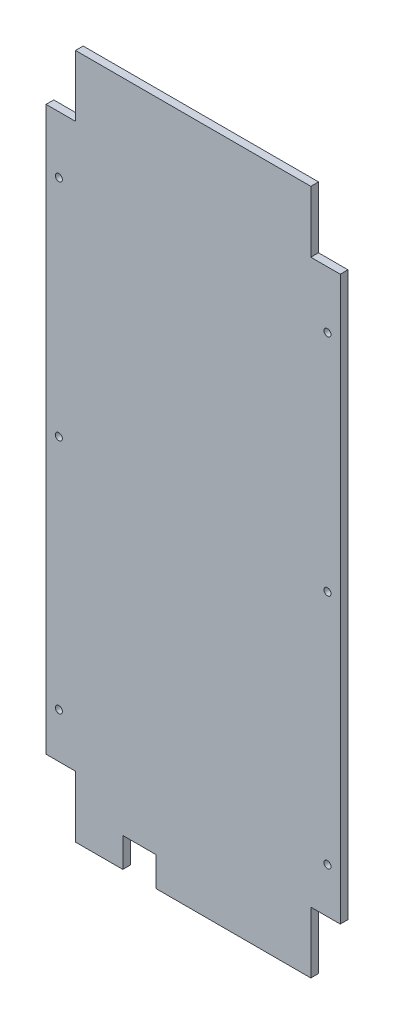
from build123d import *

# Parameters (mm, degrees)
BOSS_EXTRUDE1_DEPTH = 6
SKETCH2_R           = 2.75
CUT_EXTRUDE1_DEPTH  = 10


with BuildPart() as part:
    # Sketch1 → Boss-Extrude1 (new body)
    with BuildSketch(Plane.XY):
        Polygon((95.814780717, -438.587306273), (95.814780717, -390.58730627), (118.814780717, -390.58730627), (118.814780717, 49.41269373), (95.814780717, 49.41269373), (95.814780717, 97.41269373), (-88.185219283, 97.41269373), (-88.185219283, 49.41269373), (-111.185219283, 49.41269373), (-111.185219283, -390.58730627), (-88.185219283, -390.58730627), (-88.185219283, -438.587306273), (-51.185219283, -438.587306273), (-51.185219283, -415.587306273), (-25.185219283, -415.587306273), (-25.185219283, -438.587306273), align=None)
    extrude(amount=BOSS_EXTRUDE1_DEPTH)

    # Sketch2 → Cut-Extrude1 (cut)
    with BuildSketch(Plane(origin=(0, 0, 0), x_dir=(-1, 0, 0), z_dir=(0, 0, -1))):
        with Locations((-108.814780717, -170.58730627)):
            Circle(SKETCH2_R)
        with Locations((-108.814780717, 4.834891165)):
            Circle(SKETCH2_R)
        with Locations((-108.814780717, -355.336655309)):
            Circle(SKETCH2_R)
        with Locations((101.185219283, 4.834891165)):
            Circle(SKETCH2_R)
        with Locations((101.185219283, -170.58730627)):
            Circle(SKETCH2_R)
        with Locations((101.185219283, -355.336655309)):
            Circle(SKETCH2_R)
    extrude(amount=-CUT_EXTRUDE1_DEPTH, mode=Mode.SUBTRACT)


solid = part.part
